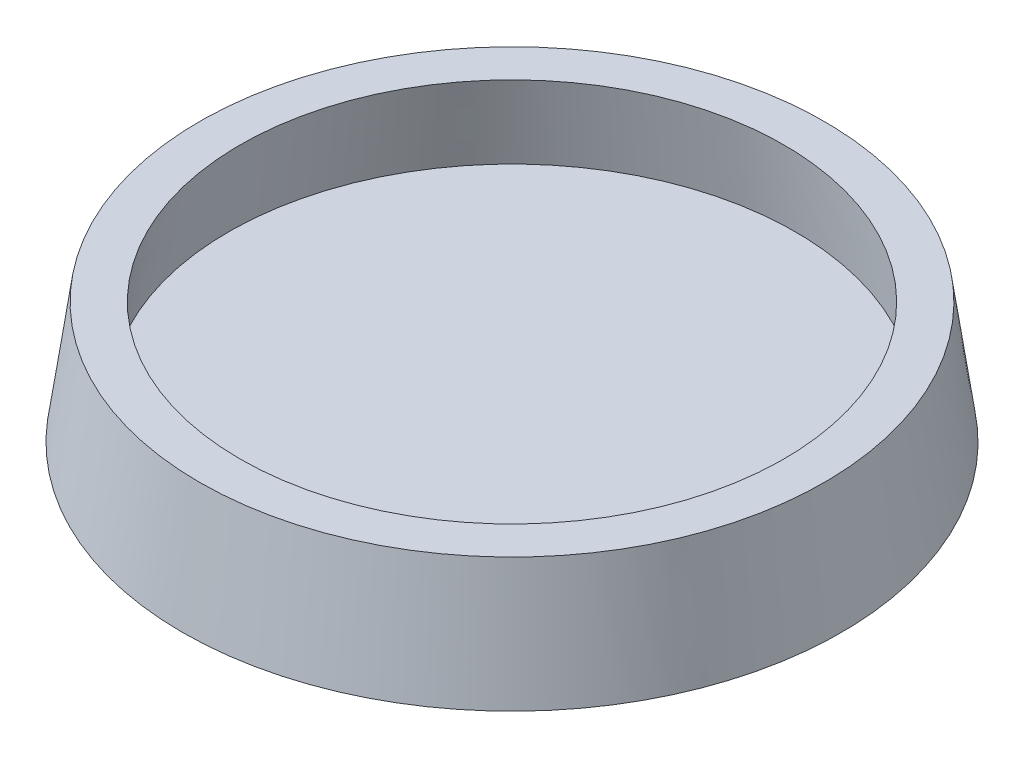
from build123d import *


with BuildPart() as part:
    # Croquis1 → Revolución1 (revolve)
    with BuildSketch(Plane(origin=(0, 0, 0), x_dir=(0, 0, -1), z_dir=(1, 0, 0)), mode=Mode.PRIVATE) as revoluci_n1_sk:
        Polygon((0, 0), (40.702704174, 0), (38.594591653, 15), (33.594591653, 15), (35, 5), (0, 5), align=None)
    revolve(revoluci_n1_sk.sketch.rotate(Axis((0, 5, 0), (0, -1, 0)), 180), axis=Axis((0, 5, 0), (0, -1, 0)))


solid = part.part
